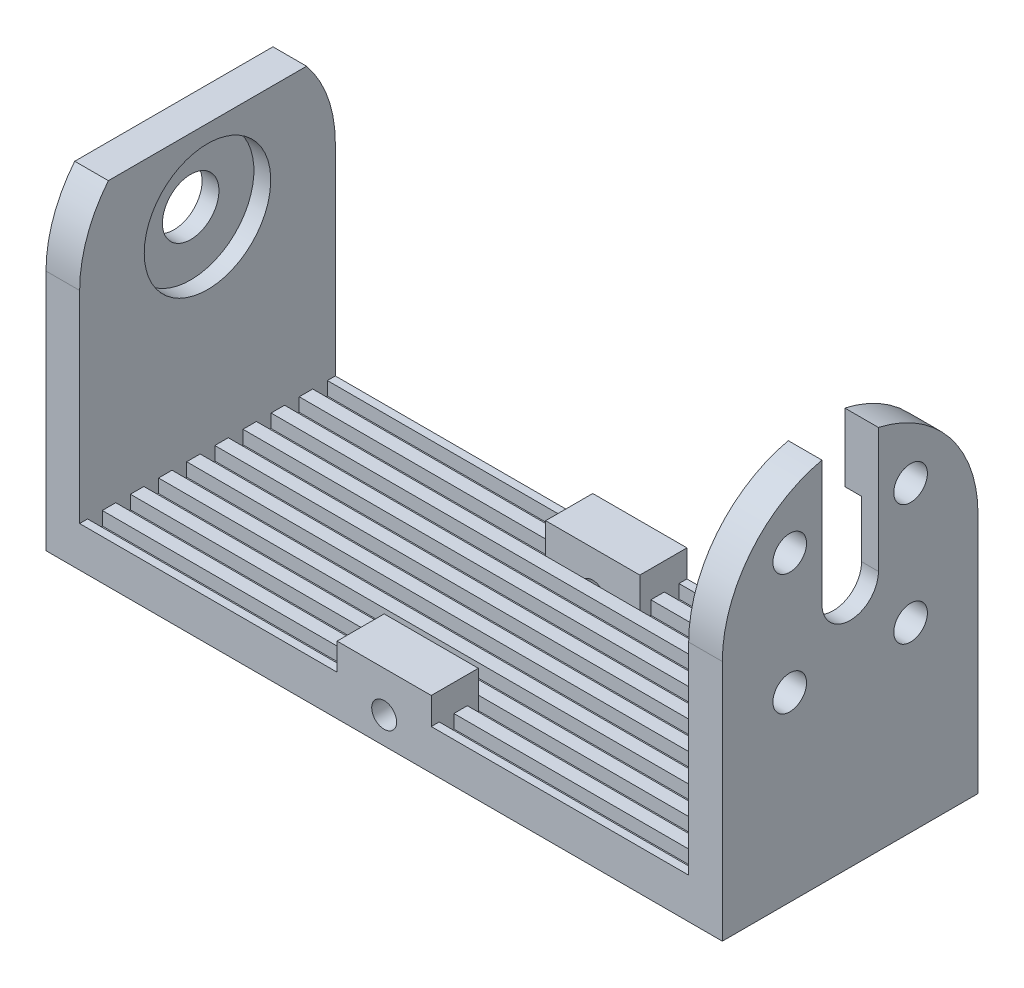
from build123d import *

# Parameters (mm, degrees)
SKETCH1_W           = 50.26
SKETCH1_H           = 24
BOSS_EXTRUDE1_DEPTH = 2
SKETCH2_W           = 2.5
SKETCH2_H           = 24
BOSS_EXTRUDE2_DEPTH = 22
SKETCH3_R           = 2.1
CUT_EXTRUDE1_DEPTH  = 57.974271386
SKETCH4_R           = 4.7
CUT_EXTRUDE2_DEPTH  = 1.25
CUT_EXTRUDE3_REACH  = 58.974
SKETCH5_R           = 1.25
CUT_EXTRUDE4_REACH  = 58.974
SKETCH7_W           = 45.26
SKETCH7_H           = 1
BOSS_EXTRUDE3_DEPTH = 1
LPATTERN3_COUNT     = 12
LPATTERN3_PITCH     = 2.090909091
BOSS_EXTRUDE4_DEPTH = 2.5
CUT_EXTRUDE6_DEPTH  = 59.424713631
BOSS_EXTRUDE5_START = -1
SKETCH12_W          = 7
SKETCH12_H          = 3.5
BOSS_EXTRUDE5_DEPTH = 3
SKETCH13_R          = 0.925
CUT_EXTRUDE7_DEPTH  = 3.5
CUT_EXTRUDE9_START  = -3.5
SKETCH14_R          = 0.925
CUT_EXTRUDE9_DEPTH  = 3.5


with BuildPart() as part:
    # Sketch1 → Boss-Extrude1 (new body)
    with BuildSketch(Plane(origin=(0, 0, 0), x_dir=(1, 0, 0), z_dir=(0, 1, 0))):
        Rectangle(SKETCH1_W, SKETCH1_H)
    extrude(amount=BOSS_EXTRUDE1_DEPTH)

    # Sketch2 → Boss-Extrude2 (add)
    with BuildSketch(Plane(origin=(0, 2, 0), x_dir=(1, 0, 0), z_dir=(0, 1, 0))):
        with Locations((-23.88, 0)):
            Rectangle(SKETCH2_W, SKETCH2_H)
        with Locations((23.88, 0)):
            Rectangle(SKETCH2_W, SKETCH2_H)
    extrude(amount=BOSS_EXTRUDE2_DEPTH)

    # Sketch3 → Cut-Extrude1 (cut, through all)
    with BuildSketch(Plane(origin=(25.13, 0, 0), x_dir=(0, 0, -1), z_dir=(1, 0, 0))):
        with Locations((0, 18)):
            Circle(SKETCH3_R)
    extrude(amount=-CUT_EXTRUDE1_DEPTH, mode=Mode.SUBTRACT)

    # Sketch4 → Cut-Extrude2 (cut)
    with BuildSketch(Plane.ZY.offset(-22.63)):
        with Locations((0, 18)):
            Circle(SKETCH4_R)
    cut_extrude2 = extrude(amount=-CUT_EXTRUDE2_DEPTH, mode=Mode.SUBTRACT)

    # Mirror1: Cut-Extrude2 across plane
    add(cut_extrude2.mirror(Plane.ZY), mode=Mode.SUBTRACT)

    # Sketch5 → Cut-Extrude3 (cut, up to next)
    with BuildSketch(Plane(origin=(25.13, 0, 0), x_dir=(0, 0, -1), z_dir=(1, 0, 0)), mode=Mode.PRIVATE) as cut_extrude3_sk1:
        with Locations((4.49015, 13.50985)):
            Circle(SKETCH5_R)
    cut_extrude3_tool1 = extrude(cut_extrude3_sk1.sketch, amount=-CUT_EXTRUDE3_REACH, mode=Mode.PRIVATE) & part.part
    # Sketch5 → Cut-Extrude3 (cut, up to next)
    with BuildSketch(Plane(origin=(25.13, 0, 0), x_dir=(0, 0, -1), z_dir=(1, 0, 0)), mode=Mode.PRIVATE) as cut_extrude3_sk2:
        with Locations((-4.49015, 13.50985)):
            Circle(SKETCH5_R)
    cut_extrude3_tool2 = extrude(cut_extrude3_sk2.sketch, amount=-CUT_EXTRUDE3_REACH, mode=Mode.PRIVATE) & part.part
    # Sketch5 → Cut-Extrude3 (cut, up to next)
    with BuildSketch(Plane(origin=(25.13, 0, 0), x_dir=(0, 0, -1), z_dir=(1, 0, 0)), mode=Mode.PRIVATE) as cut_extrude3_sk3:
        with Locations((-4.49015, 22.49015)):
            Circle(SKETCH5_R)
    cut_extrude3_tool3 = extrude(cut_extrude3_sk3.sketch, amount=-CUT_EXTRUDE3_REACH, mode=Mode.PRIVATE) & part.part
    # Sketch5 → Cut-Extrude3 (cut, up to next)
    with BuildSketch(Plane(origin=(25.13, 0, 0), x_dir=(0, 0, -1), z_dir=(1, 0, 0)), mode=Mode.PRIVATE) as cut_extrude3_sk4:
        with Locations((4.49015, 22.49015)):
            Circle(SKETCH5_R)
    cut_extrude3_tool4 = extrude(cut_extrude3_sk4.sketch, amount=-CUT_EXTRUDE3_REACH, mode=Mode.PRIVATE) & part.part
    add(cut_extrude3_tool1.solids().sort_by_distance((25.13, 13.50985, -4.49015))[0], mode=Mode.SUBTRACT)
    add(cut_extrude3_tool2.solids().sort_by_distance((25.13, 13.50985, 4.49015))[0], mode=Mode.SUBTRACT)
    add(cut_extrude3_tool3.solids().sort_by_distance((25.13, 22.49015, 4.49015))[0], mode=Mode.SUBTRACT)
    add(cut_extrude3_tool4.solids().sort_by_distance((25.13, 22.49015, -4.49015))[0], mode=Mode.SUBTRACT)

    # Sketch6 → Cut-Extrude4 (cut, up to next)
    with BuildSketch(Plane(origin=(25.13, 0, 0), x_dir=(0, 0, -1), z_dir=(1, 0, 0)), mode=Mode.PRIVATE) as cut_extrude4_sk1:
        with BuildLine():
            Line((-2.1, 18), (-2.1, 24))
            Line((-2.1, 24), (2.1, 24))
            Line((2.1, 24), (2.1, 18))
            ThreePointArc((2.1, 18), (0, 15.9), (-2.1, 18))
        make_face()
    cut_extrude4_tool1 = extrude(cut_extrude4_sk1.sketch, amount=-CUT_EXTRUDE4_REACH, mode=Mode.PRIVATE) & part.part
    add(cut_extrude4_tool1.solids().sort_by_distance((25.13, 20.160972, 0))[0], mode=Mode.SUBTRACT)

    # Sketch7 → Boss-Extrude3 (add)
    with BuildSketch(Plane(origin=(0, 2, 0), x_dir=(1, 0, 0), z_dir=(0, 1, 0))):
        with Locations((0, -11.5)):
            Rectangle(SKETCH7_W, SKETCH7_H)
    boss_extrude3 = extrude(amount=BOSS_EXTRUDE3_DEPTH)

    # LPattern3: Boss-Extrude3 ×12
    with Locations(*[(0, 0, -i * LPATTERN3_PITCH) for i in range(1, LPATTERN3_COUNT)]):
        add(boss_extrude3)

    # Sketch9 → Boss-Extrude4 (add)
    with BuildSketch(Plane(origin=(25.13, 0, 0), x_dir=(0, 0, -1), z_dir=(1, 0, 0))):
        with BuildLine():
            Line((2.1, 24), (7.365459931, 24))
            ThreePointArc((7.365459931, 24), (5.006372874, 26.073799022), (2.1, 27.264987858))
            Line((2.1, 27.264987858), (2.1, 24))
        make_face()
        with BuildLine():
            Line((-7.365459931, 24), (-2.1, 24))
            Line((-2.1, 24), (-2.1, 27.264987858))
            ThreePointArc((-2.1, 27.264987858), (-5.006372874, 26.073799022), (-7.365459931, 24))
        make_face()
    extrude(amount=-BOSS_EXTRUDE4_DEPTH)

    # Sketch10 → Cut-Extrude6 (cut, through all)
    with BuildSketch(Plane(origin=(25.13, 0, 0), x_dir=(0, 0, -1), z_dir=(1, 0, 0))):
        with BuildLine():
            Line((-9.5, 0), (-9.5, 18))
            ThreePointArc((-9.5, 18), (-8.950471198, 21.184189901), (-7.365459931, 24))
            Line((-7.365459931, 24), (-9.5, 24))
            Line((-9.5, 24), (-12, 24))
            Line((-12, 24), (-12, 0))
            Line((-12, 0), (-9.5, 0))
        make_face()
        with BuildLine():
            Line((9.5, 24), (7.365459931, 24))
            ThreePointArc((7.365459931, 24), (8.950471198, 21.184189901), (9.5, 18))
            Line((9.5, 18), (9.5, 0))
            Line((9.5, 0), (12, 0))
            Line((12, 0), (12, 24))
            Line((12, 24), (9.5, 24))
        make_face()
    extrude(amount=-CUT_EXTRUDE6_DEPTH, mode=Mode.SUBTRACT)

    # Sketch12 → Boss-Extrude5 (add)
    with BuildSketch(Plane(origin=(0, 3, 0), x_dir=(1, 0, 0), z_dir=(0, 1, 0)).offset(BOSS_EXTRUDE5_START)):
        with Locations((0, -7.75)):
            Rectangle(SKETCH12_W, SKETCH12_H)
    boss_extrude5 = extrude(amount=BOSS_EXTRUDE5_DEPTH)

    # Mirror2: Boss-Extrude5 across plane
    add(boss_extrude5.mirror(Plane.XY))

    # Sketch13 → Cut-Extrude7 (cut)
    with BuildSketch(Plane(origin=(0, 0, -9.5), x_dir=(-1, 0, 0), z_dir=(0, 0, -1))):
        with Locations(Location((0, 2, 0), (0, 0, 90))):
            Circle(SKETCH13_R)
    extrude(amount=-CUT_EXTRUDE7_DEPTH, mode=Mode.SUBTRACT)

    # Sketch14 → Cut-Extrude9 (cut)
    with BuildSketch(Plane.XY.offset(9.5).offset(CUT_EXTRUDE9_START)):
        with Locations(Location((0, 2, 0), (0, 0, 90))):
            Circle(SKETCH14_R)
    extrude(amount=CUT_EXTRUDE9_DEPTH, mode=Mode.SUBTRACT)


solid = part.part
